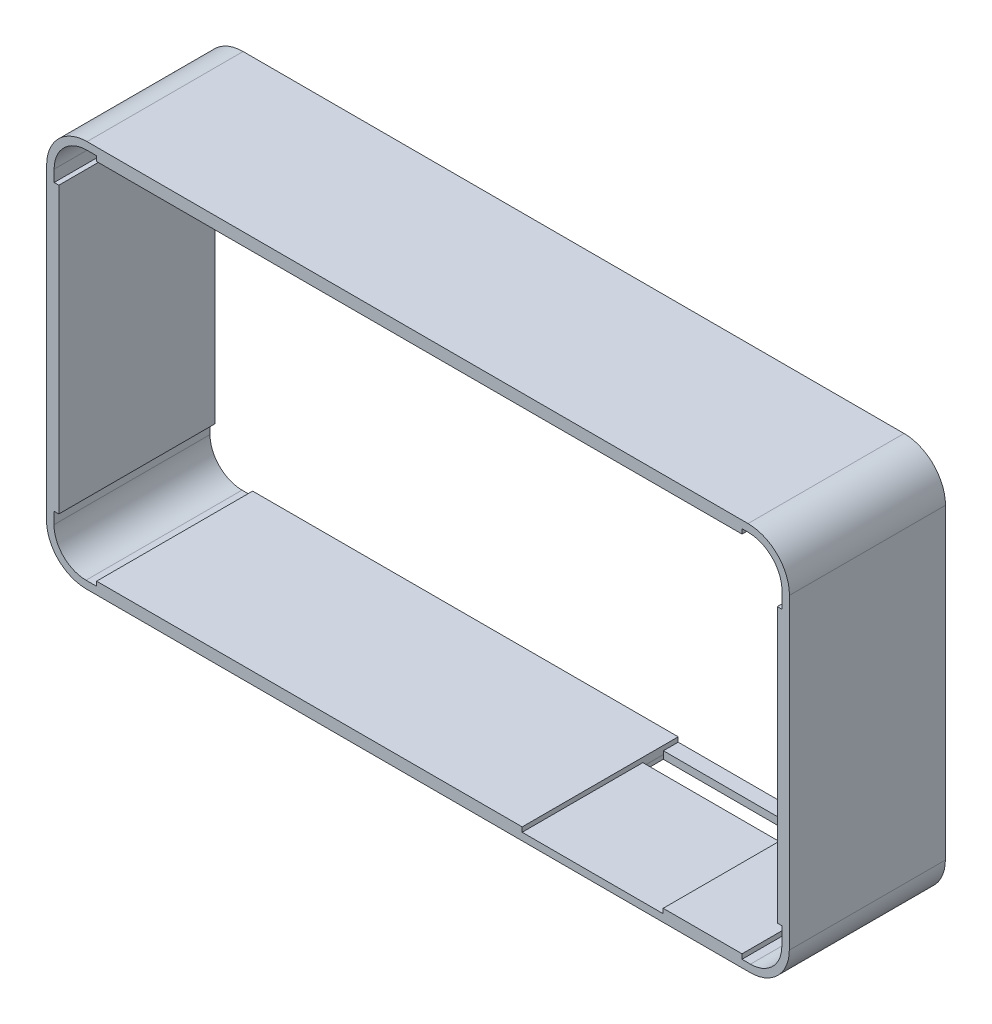
from build123d import *

# Parameters (mm, degrees)
EXTRUDE_1_DEPTH     = 16.7
SKETCH_3_W          = 15.099715766
SKETCH_3_H          = 2.203775642
CUT_EXTRUDE_1_DEPTH = 5
SKETCH_4_W          = 0.38725248
SKETCH_4_H          = 3
SKETCH_4_W_2        = 3
SKETCH_4_H_2        = 0.383109263
SKETCH_4_W_3        = 0.4
SKETCH_4_W_4        = 0.388780164
SKETCH_4_H_3        = 0.4
SKETCH_4_H_4        = 0.38857705
SKETCH_4_W_5        = 3.37605038
SKETCH_4_W_6        = 2.722344729
SKETCH_4_H_5        = 0.392885085
SKETCH_4_W_7        = 3.226877137
SKETCH_4_H_6        = 0.371411749
EXTRUDE_2_DEPTH     = 16.7
EXTRUDE_START       = -16.7
SKETCH_6_W          = 0.796868143
SKETCH_6_H          = 29.338375801
SKETCH_6_W_2        = 8.436859724
SKETCH_6_H_2        = 0.85179164
SKETCH_6_W_3        = 45.549197179
SKETCH_6_W_4        = 1.179184796
SKETCH_6_H_3        = 30.473345103
SKETCH_6_W_5        = 69.07677303
SKETCH_6_H_4        = 1.021717215
EXTRUDE_3_DEPTH     = 16.7


with BuildPart() as part:
    # 草图1 → 凸台-拉伸1 (new body)
    with BuildSketch(Plane.XY):
        with BuildLine():
            Line((2.855494038, -1.387278341), (5.800401001, -1.388665967))
            Line((5.800401001, -1.388665967), (70.985308674, -1.419380793))
            Line((70.985308674, -1.419380793), (73.927675632, -1.420767222))
            ThreePointArc((73.927675632, -1.420767222), (76.884881883, -0.197484463), (78.110950942, 2.758567664))
            Line((78.110950942, 2.758567664), (78.112355975, 5.740415772))
            Line((78.112355975, 5.740415772), (78.125181077, 32.958640512))
            Line((78.125181077, 32.958640512), (78.126450001, 35.651629799))
            ThreePointArc((78.126450001, 35.651629799), (76.828856853, 38.788476566), (73.693234318, 40.089025273))
            Line((73.693234318, 40.089025273), (70.98932047, 40.090299344))
            Line((70.98932047, 40.090299344), (5.775052881, 40.121028004))
            Line((5.775052881, 40.121028004), (2.954100692, 40.122357224))
            ThreePointArc((2.954100692, 40.122357224), (-0.103921613, 38.857370731), (-1.371789395, 35.800541896))
            Line((-1.371789395, 35.800541896), (-1.373118614, 32.979589707))
            Line((-1.373118614, 32.979589707), (-1.385933032, 5.784037735))
            Line((-1.385933032, 5.784037735), (-1.387311048, 2.85952701))
            ThreePointArc((-1.387311048, 2.85952701), (-0.145450691, -0.14258937), (2.855494038, -1.387278341))
        make_face()
        with BuildLine():
            Line((70.988943514, 39.290299433), (5.774675925, 39.321028093))
            Line((5.774675925, 39.321028093), (2.945484428, 39.321028093))
            ThreePointArc((2.945484428, 39.321028093), (0.458983687, 38.291428909), (-0.57178701, 35.805413586))
            Line((-0.57178701, 35.805413586), (-0.587318509, 2.843504746))
            ThreePointArc((-0.587318509, 2.843504746), (0.415916655, 0.418249199), (2.840225686, -0.587271057))
            Line((2.840225686, -0.587271057), (73.950700839, -0.620777983))
            ThreePointArc((73.950700839, -0.620777983), (76.326093463, 0.361830803), (77.31094036, 2.736296371))
            Line((77.31094036, 2.736296371), (77.326458049, 35.668898432))
            ThreePointArc((77.326458049, 35.668898432), (76.260744014, 38.23512367), (73.689645726, 39.289026875))
            Line((73.689645726, 39.289026875), (70.988943514, 39.290299433))
        make_face(mode=Mode.SUBTRACT)
    extrude(amount=EXTRUDE_1_DEPTH)

    # 草图3 → 切除-拉伸1 (cut)
    with BuildSketch(Plane(origin=(-0.000276089, -0.585932626, 0), x_dir=(0.9999998889874869, -0.0004711953032664496, 0), z_dir=(0.0004711953032664496, 0.9999998889874869, 0))):
        with Locations((57.063897747, -2.688044793)):
            Rectangle(SKETCH_3_W, SKETCH_3_H)
    extrude(amount=-CUT_EXTRUDE_1_DEPTH, mode=Mode.SUBTRACT)

    # 草图4 → 凸台-拉伸2 (add)
    with BuildSketch(Plane.XY):
        with Locations((77.118267417, 6.259444326)):
            Rectangle(SKETCH_4_W, SKETCH_4_H)
        with Locations((30.266902253, -0.407932956)):
            Rectangle(SKETCH_4_W_2, SKETCH_4_H_2)
        with Locations((-0.385271584, 5.687615959)):
            Rectangle(SKETCH_4_W_3, SKETCH_4_H)
        with Locations((-0.379661666, 32.499046592)):
            Rectangle(SKETCH_4_W_4, SKETCH_4_H)
        with Locations((24.872797996, 39.11273594)):
            Rectangle(SKETCH_4_W_2, SKETCH_4_H_3)
        with Locations((49.115290001, 39.107024465)):
            Rectangle(SKETCH_4_W_2, SKETCH_4_H_4)
        with Locations((77.124641177, 30.313021772)):
            Rectangle(SKETCH_4_W_3, SKETCH_4_H)
        with Locations((66.301497558, -0.416378324)):
            Rectangle(SKETCH_4_W_5, SKETCH_4_H_3)
        with Locations((48.152585915, -0.412820867)):
            Rectangle(SKETCH_4_W_6, SKETCH_4_H_5)
        with Locations((5.555152303, -0.402084199)):
            Rectangle(SKETCH_4_W_7, SKETCH_4_H_6)
    extrude(amount=EXTRUDE_2_DEPTH)


with BuildPart() as extrude_2_piece_1:
    # of the separate pieces the step leaves, piece 1, a body of its own (extrude_2_pieces)
    add(part.part.solids().sort_by_distance((73.693234318, 40.089025273, 0))[0])



with BuildPart() as extrude_2_piece_2:
    # of the separate pieces the step leaves, piece 2, a body of its own (extrude_2_pieces)
    add(part.part.solids().sort_by_distance((67.989522748, -0.616378324, 0))[0])


with BuildPart() as extrude_2_piece_3:
    # of the separate pieces the step leaves, piece 3, a body of its own (extrude_2_pieces)
    add(part.part.solids().sort_by_distance((-0.185271584, 7.187615959, 0))[0])


with BuildPart() as extrude_2_piece_4:
    # of the separate pieces the step leaves, piece 4, a body of its own (extrude_2_pieces)
    add(part.part.solids().sort_by_distance((7.168590872, -0.587790073, 0))[0])


with BuildPart() as extrude_2_piece_5:
    # of the separate pieces the step leaves, piece 5, a body of its own (extrude_2_pieces)
    add(part.part.solids().sort_by_distance((76.924641177, 4.759444326, 0))[0])


with BuildPart() as extrude_2_piece_6:
    # of the separate pieces the step leaves, piece 6, a body of its own (extrude_2_pieces)
    add(part.part.solids().sort_by_distance((31.766902253, -0.599487587, 0))[0])


with BuildPart() as extrude_2_piece_1_1:
    add(extrude_2_piece_1.part)

    add(extrude_2_piece_5.part)  # 凸台-拉伸3 merges 凸台-拉伸2 piece 5
    # 草图6 → 凸台-拉伸3 (add)
    with BuildSketch(Plane.XY.offset(16.7).offset(EXTRUDE_START)):
        with Locations((77.22408829, 19.293888192)):
            Rectangle(SKETCH_6_W, SKETCH_6_H)
        with Locations((68.83190223, -0.535163223)):
            Rectangle(SKETCH_6_W_2, SKETCH_6_H_2)
        with Locations((26.747754173, -0.535163223)):
            Rectangle(SKETCH_6_W_3, SKETCH_6_H_2)
        with Locations((-0.661963251, 19.329556786)):
            Rectangle(SKETCH_6_W_4, SKETCH_6_H_3)
        with Locations((38.511945577, 39.300186669)):
            Rectangle(SKETCH_6_W_5, SKETCH_6_H_4)
    extrude(amount=EXTRUDE_3_DEPTH)


solid = Compound([extrude_2_piece_2.part, extrude_2_piece_3.part, extrude_2_piece_4.part, extrude_2_piece_6.part, extrude_2_piece_1_1.part])
